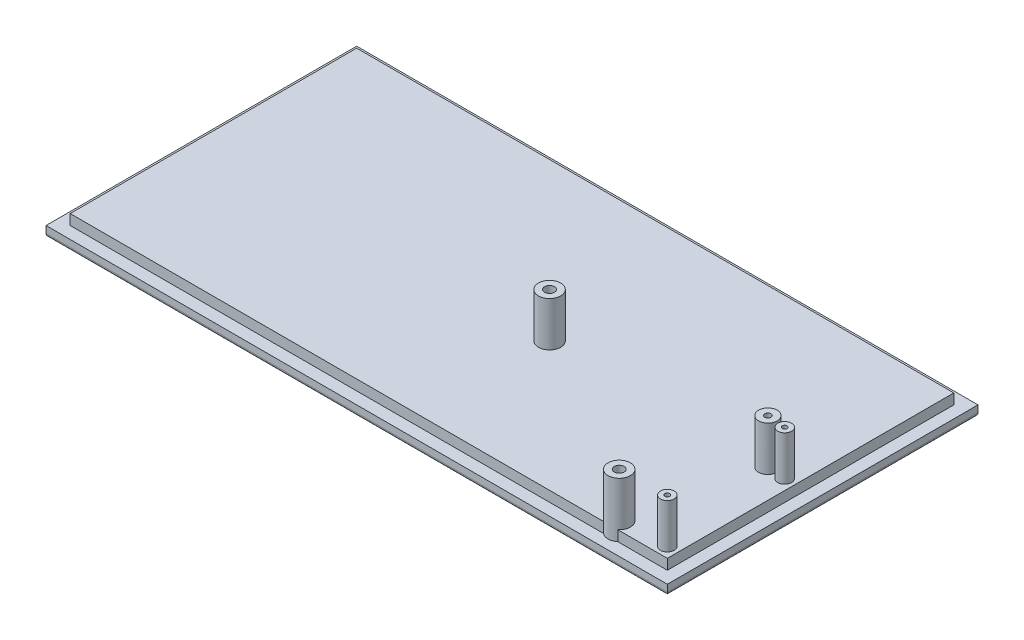
from build123d import *

# Parameters (mm, degrees)
SKETCH_1_W      = 180
SKETCH_1_H      = 90
EXTRUDE_1_DEPTH = 3
FILLET_1_R      = 1
SKETCH_2_W      = 173
SKETCH_2_H      = 83
EXTRUDE_2_DEPTH = 3
SKETCH_5_R      = 2.695
SKETCH_5_R_2    = 0.895
SKETCH_5_R_3    = 2
SKETCH_5_R_4    = 0.7
SKETCH_5_R_5    = 3.225
SKETCH_5_R_6    = 1.425
EXTRUDE_3_DEPTH = 15.90000066


with BuildPart() as part:
    # 草图1 → 凸台-拉伸1 (new body)
    with BuildSketch(Plane(origin=(0, 0, 0), x_dir=(1, 0, 0), z_dir=(0, 1, 0))):
        Rectangle(SKETCH_1_W, SKETCH_1_H)
    extrude(amount=EXTRUDE_1_DEPTH)

    # 圆角1
    fillet_1_edges = [part.edges().sort_by_distance(p)[0] for p in [
        (0, 0, -45),
        (90, 0, 0),
        (0, 0, 45),
        (-90, 0, 0),
    ]]
    fillet(fillet_1_edges, radius=FILLET_1_R)

    # 草图2 → 凸台-拉伸2 (add)
    with BuildSketch(Plane(origin=(0, 3, 0), x_dir=(1, 0, 0), z_dir=(0, 1, 0))):
        Rectangle(SKETCH_2_W, SKETCH_2_H)
    extrude(amount=EXTRUDE_2_DEPTH)

    # 草图5 → 凸台-拉伸3 (add)
    # profile 1 of 5: a face of its own
    with BuildSketch(Plane(origin=(0, 3, 0), x_dir=(1, 0, 0), z_dir=(0, 1, 0))):
        with Locations((78.142, -4.005)):
            Circle(SKETCH_5_R)
        with Locations((78.142, -4.005)):
            Circle(SKETCH_5_R_2, mode=Mode.SUBTRACT)
    # profile 2 of 5: a face of its own
    with BuildSketch(Plane(origin=(0, 3, 0), x_dir=(1, 0, 0), z_dir=(0, 1, 0))):
        with Locations((83.5, -4.5)):
            Circle(SKETCH_5_R_3)
        with Locations((83.5, -4.5)):
            Circle(SKETCH_5_R_4, mode=Mode.SUBTRACT)
    # profile 3 of 5: a face of its own
    with BuildSketch(Plane(origin=(0, 3, 0), x_dir=(1, 0, 0), z_dir=(0, 1, 0))):
        with Locations((83.5, -38.5)):
            Circle(SKETCH_5_R_3)
        with Locations((83.5, -38.5)):
            Circle(SKETCH_5_R_4, mode=Mode.SUBTRACT)
    # profile 4 of 5: a face of its own
    with BuildSketch(Plane(origin=(0, 3, 0), x_dir=(1, 0, 0), z_dir=(0, 1, 0))):
        with Locations((14.882, -4.005)):
            Circle(SKETCH_5_R_5)
        with Locations((14.882, -4.005)):
            Circle(SKETCH_5_R_6, mode=Mode.SUBTRACT)
    # profile 5 of 5: a face of its own
    with BuildSketch(Plane(origin=(0, 3, 0), x_dir=(1, 0, 0), z_dir=(0, 1, 0))):
        with Locations((70.082, -39.015)):
            Circle(SKETCH_5_R_5)
        with Locations((70.082, -39.015)):
            Circle(SKETCH_5_R_6, mode=Mode.SUBTRACT)
    extrude(amount=EXTRUDE_3_DEPTH)


solid = part.part
